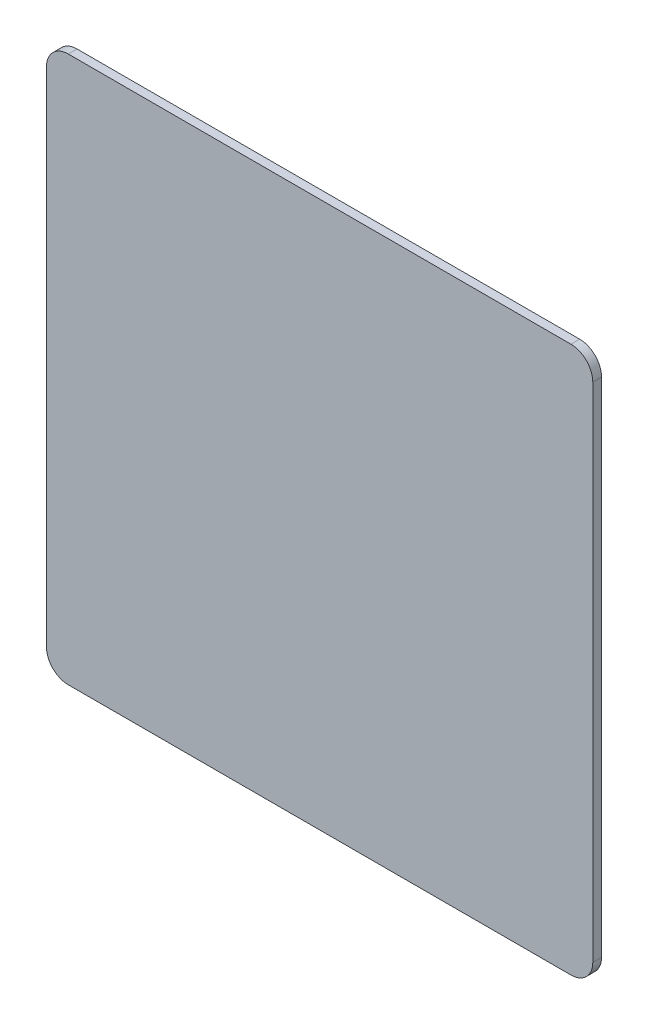
from build123d import *

# Parameters (mm, degrees)
SKETCH1_W           = 250
SKETCH1_H           = 250
BOSS_EXTRUDE1_DEPTH = 4
FILLET1_R           = 10


with BuildPart() as part:
    # Sketch1 → Boss-Extrude1 (new body)
    with BuildSketch(Plane.XY):
        with Locations((125, -125)):
            Rectangle(SKETCH1_W, SKETCH1_H)
    extrude(amount=BOSS_EXTRUDE1_DEPTH)

    # Fillet1
    fillet1_edges = [part.edges().sort_by_distance(p)[0] for p in [
        (0, 0, 2),
        (250, 0, 2),
        (250, -250, 2),
        (0, -250, 2),
    ]]
    fillet(fillet1_edges, radius=FILLET1_R)


solid = part.part
